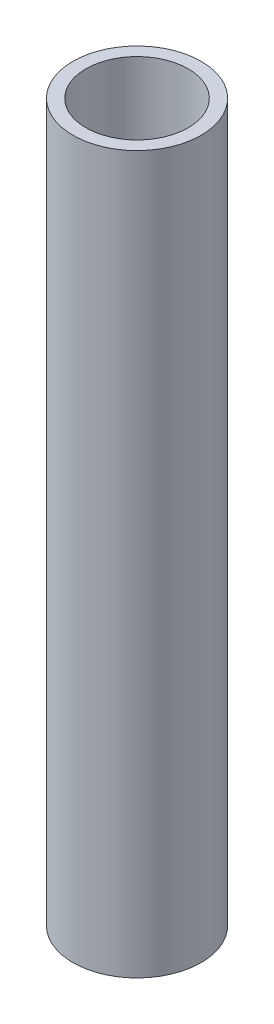
from build123d import *

# Parameters (mm, degrees)
SKETCH1_R           = 16.7005
SKETCH1_R_2         = 13.3223
BOSS_EXTRUDE1_DEPTH = 186.69


with BuildPart() as part:
    # Sketch1 → Boss-Extrude1 (new body)
    with BuildSketch(Plane(origin=(0, 0, 0), x_dir=(1, 0, 0), z_dir=(0, 1, 0))):
        with Locations(Location((0, 0, 0), (0, 0, 90))):
            Circle(SKETCH1_R)
        with Locations(Location((0, 0, 0), (0, 0, 90))):
            Circle(SKETCH1_R_2, mode=Mode.SUBTRACT)
    extrude(amount=BOSS_EXTRUDE1_DEPTH)


solid = part.part
